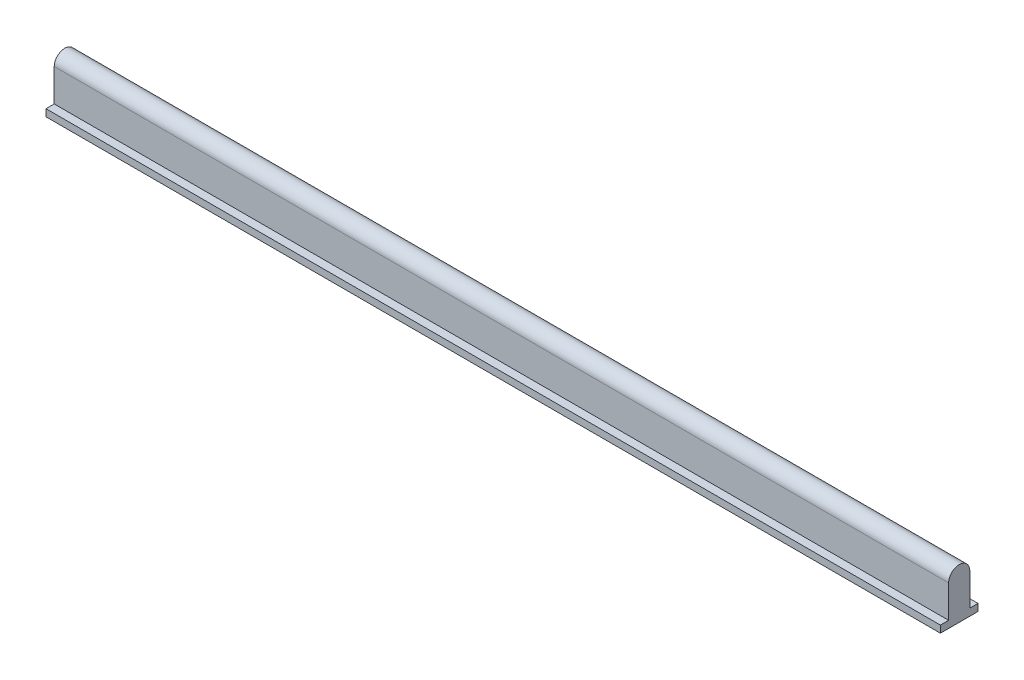
from build123d import *

# Parameters (mm, degrees)
BOSS_EXTRUDE1_DEPTH = 507.8


with BuildPart() as part:
    # Sketch2 → Boss-Extrude1 (new body)
    with BuildSketch(Plane(origin=(0, 0, 0), x_dir=(0, 0, -1), z_dir=(1, 0, 0))):
        with BuildLine():
            Line((6, -20.036364033), (10.669721768, -20.036364033))
            Line((10.669721768, -20.036364033), (10.669721768, -24.036364033))
            Line((10.669721768, -24.036364033), (-10.669721768, -24.036364033))
            Line((-10.669721768, -24.036364033), (-10.669721768, -20.036364033))
            Line((-10.669721768, -20.036364033), (-6, -20.036364033))
            Line((-6, -20.036364033), (-6, -1.636364033))
            ThreePointArc((-6, -1.636364033), (0, 4.363635967), (6, -1.636364033))
            Line((6, -1.636364033), (6, -20.036364033))
        make_face()
    extrude(amount=BOSS_EXTRUDE1_DEPTH)


solid = part.part
